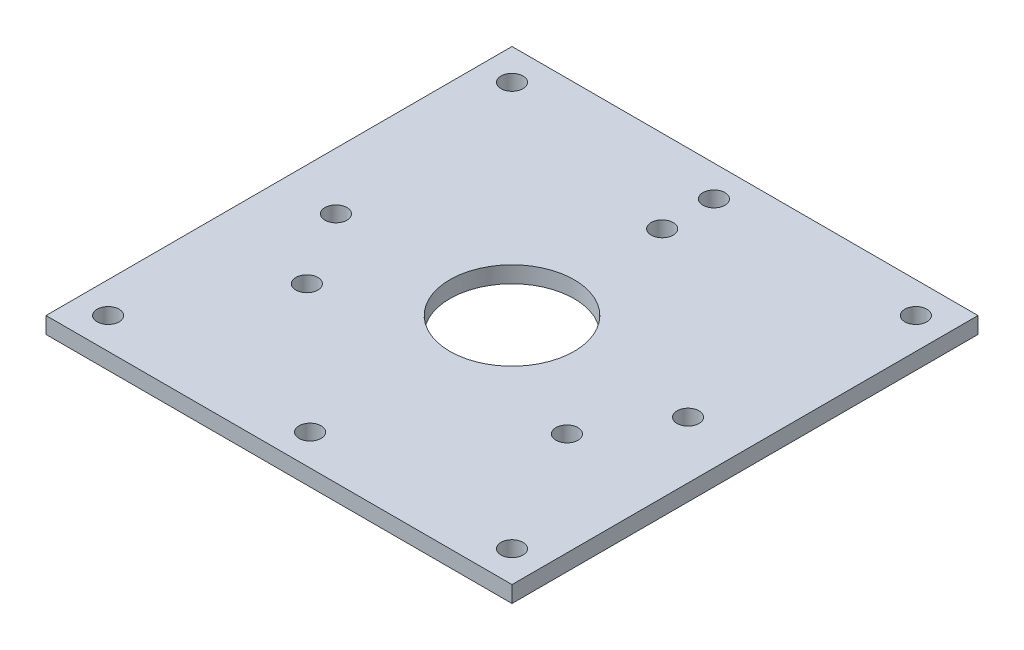
from build123d import *

# Parameters (mm, degrees)
SKETCH1_W           = 90
SKETCH1_H           = 90
SKETCH1_R           = 12
SKETCH1_R_2         = 2.125
BOSS_EXTRUDE1_DEPTH = 3.175


with BuildPart() as part:
    # Sketch1 → Boss-Extrude1 (new body)
    with BuildSketch(Plane(origin=(0, 0, 0), x_dir=(1, 0, 0), z_dir=(0, 1, 0))):
        Rectangle(SKETCH1_W, SKETCH1_H)
        with Locations(Location((0, 0, 0), (0, 0, 270))):
            Circle(SKETCH1_R, mode=Mode.SUBTRACT)
        with Locations(Location((0, 29, 0), (0, 0, 270))):
            Circle(SKETCH1_R_2, mode=Mode.SUBTRACT)
        with Locations(Location((25.11473671, -14.5, 0), (0, 0, 270))):
            Circle(SKETCH1_R_2, mode=Mode.SUBTRACT)
        with Locations(Location((-25.11473671, -14.5, 0), (0, 0, 270))):
            Circle(SKETCH1_R_2, mode=Mode.SUBTRACT)
        with Locations(Location((-39, -39, 0), (0, 0, 270))):
            Circle(SKETCH1_R_2, mode=Mode.SUBTRACT)
        with Locations(Location((-34, 0, 0), (0, 0, 270))):
            Circle(SKETCH1_R_2, mode=Mode.SUBTRACT)
        with Locations(Location((-39, 39, 0), (0, 0, 90))):
            Circle(SKETCH1_R_2, mode=Mode.SUBTRACT)
        with Locations(Location((39, -39, 0), (0, 0, 90))):
            Circle(SKETCH1_R_2, mode=Mode.SUBTRACT)
        with Locations(Location((34, 0, 0), (0, 0, 90))):
            Circle(SKETCH1_R_2, mode=Mode.SUBTRACT)
        with Locations(Location((39, 39, 0), (0, 0, 270))):
            Circle(SKETCH1_R_2, mode=Mode.SUBTRACT)
        with Locations(Location((0, -39, 0), (0, 0, 270))):
            Circle(SKETCH1_R_2, mode=Mode.SUBTRACT)
        with Locations(Location((0, 39, 0), (0, 0, 90))):
            Circle(SKETCH1_R_2, mode=Mode.SUBTRACT)
    extrude(amount=BOSS_EXTRUDE1_DEPTH)


solid = part.part
